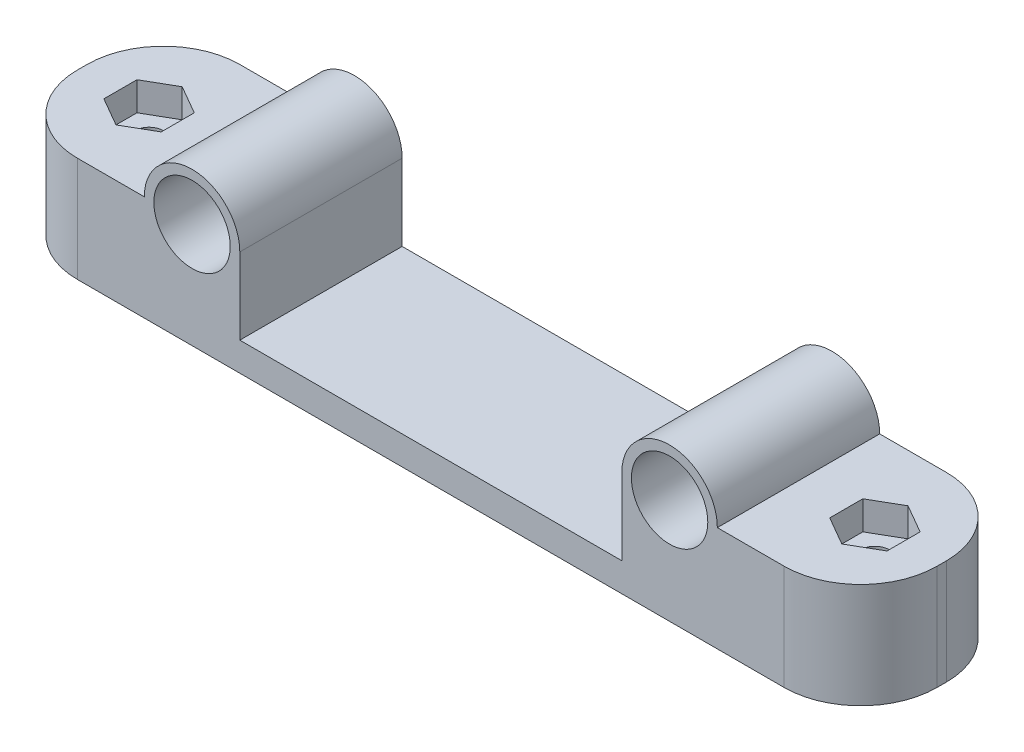
from build123d import *

# Parameters (mm, degrees)
SKETCH1_R           = 4
BOSS_EXTRUDE1_DEPTH = 15
BOSS_EXTRUDE2_START = 2
BOSS_EXTRUDE2_DEPTH = 2
SKETCH3_R           = 1.5
CUT_EXTRUDE1_DEPTH  = 49.692915296
FILLET1_R           = 8
CUT_EXTRUDE2_DEPTH  = 3


with BuildPart() as part:
    # Sketch1 → Boss-Extrude1 (new body)
    with BuildSketch(Plane.XY):
        with BuildLine():
            Line((-45, 0), (45, 0))
            Line((45, 0), (45, 11))
            Line((45, 11), (30, 11))
            ThreePointArc((30, 11), (25, 16), (20, 11))
            Line((20, 11), (20, 3))
            Line((20, 3), (-20, 3))
            Line((-20, 3), (-20, 11))
            ThreePointArc((-20, 11), (-25, 16), (-30, 11))
            Line((-30, 11), (-45, 11))
            Line((-45, 11), (-45, 0))
        make_face()
        with Locations((25, 11)):
            Circle(SKETCH1_R, mode=Mode.SUBTRACT)
        with Locations(Location((-25, 11, 0), (0, 0, 180))):
            Circle(SKETCH1_R, mode=Mode.SUBTRACT)
    extrude(amount=BOSS_EXTRUDE1_DEPTH)

    # Sketch2 → Boss-Extrude2 (add)
    with BuildSketch(Plane(origin=(0, 0, 0), x_dir=(-1, 0, 0), z_dir=(0, 0, -1)).offset(BOSS_EXTRUDE2_START)):
        with BuildLine():
            Line((-45, 11), (-45, 0))
            Line((-45, 0), (45, 0))
            Line((45, 0), (45, 11))
            Line((45, 11), (30, 11))
            ThreePointArc((30, 11), (25, 16), (20, 11))
            Line((20, 11), (20, 3))
            Line((20, 3), (-20, 3))
            Line((-20, 3), (-20, 11))
            ThreePointArc((-20, 11), (-25, 16), (-30, 11))
            Line((-30, 11), (-45, 11))
        make_face()
    extrude(amount=-BOSS_EXTRUDE2_DEPTH)

    # Sketch3 → Cut-Extrude1 (cut, through all)
    with BuildSketch(Plane(origin=(0, 11, 0), x_dir=(1, 0, 0), z_dir=(0, 1, 0))):
        with Locations(Location((38, -6.5, 0), (0, 0, 270))):
            Circle(SKETCH3_R)
    cut_extrude1 = extrude(amount=-CUT_EXTRUDE1_DEPTH, mode=Mode.SUBTRACT)

    # Mirror1: Cut-Extrude1 across plane
    add(cut_extrude1.mirror(Plane(origin=(0, 0, 0), x_dir=(0, 0, 1), z_dir=(1, 0, 0))), mode=Mode.SUBTRACT)

    # Fillet1
    fillet1_edges = [part.edges().sort_by_distance(p)[0] for p in [
        (-45, 5.5, 15),
        (45, 5.5, 15),
        (45, 5.5, -2),
        (-45, 5.5, -2),
    ]]
    fillet(fillet1_edges, radius=FILLET1_R)

    # Sketch4 → Cut-Extrude2 (cut)
    with BuildSketch(Plane(origin=(0, 11, 0), x_dir=(1, 0, 0), z_dir=(0, 1, 0))):
        Polygon((38, -3.035898385), (35, -4.767949192), (35, -8.232050808), (38, -9.964101615), (41, -8.232050808), (41, -4.767949192), align=None)
    cut_extrude2 = extrude(amount=-CUT_EXTRUDE2_DEPTH, mode=Mode.SUBTRACT)

    # Mirror3: Cut-Extrude2 across plane
    add(cut_extrude2.mirror(Plane(origin=(0, 0, 0), x_dir=(0, 0, 1), z_dir=(1, 0, 0))), mode=Mode.SUBTRACT)


solid = part.part
